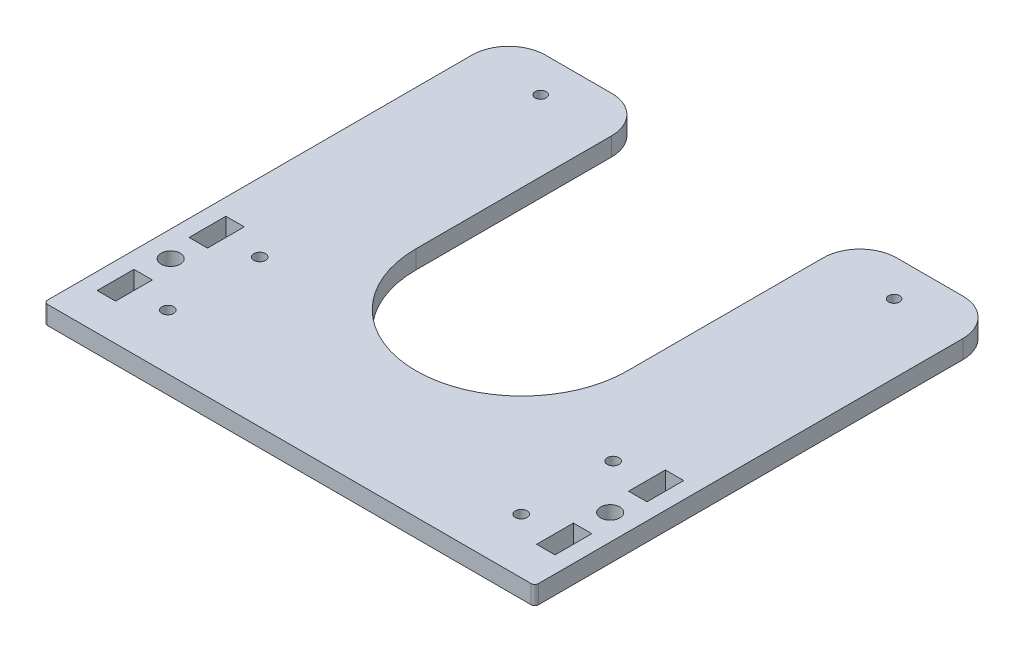
from build123d import *

# Parameters (mm, degrees)
SKETCH1_W           = 133.5
SKETCH1_H           = 126.4
SKETCH1_R           = 2.6
SKETCH1_R_2         = 1.6
SKETCH1_W_2         = 5
SKETCH1_H_2         = 10
BOSS_EXTRUDE1_DEPTH = 5
CUT_EXTRUDE2_DEPTH  = 10
FILLET2_R           = 10
CUT_EXTRUDE3_REACH  = 94.059
SKETCH5_R           = 1.6
SKETCH5_R_2         = 1.5
FILLET3_R           = 1


with BuildPart() as part:
    # Sketch1 → Boss-Extrude1 (new body)
    with BuildSketch(Plane(origin=(0, 0, 0), x_dir=(1, 0, 0), z_dir=(0, 1, 0))):
        Rectangle(SKETCH1_W, SKETCH1_H)
        with Locations(Location((-59.75, -35.7, 0), (0, 0, 270))):
            Circle(SKETCH1_R, mode=Mode.SUBTRACT)
        with Locations(Location((59.75, -35.7, 0), (0, 0, 90))):
            Circle(SKETCH1_R, mode=Mode.SUBTRACT)
        with Locations(Location((-48.05, -48.2, 0), (0, 0, 270))):
            Circle(SKETCH1_R_2, mode=Mode.SUBTRACT)
        with Locations(Location((48.05, -48.2, 0), (0, 0, 90))):
            Circle(SKETCH1_R_2, mode=Mode.SUBTRACT)
        with Locations((-59.75, -48.2)):
            Rectangle(SKETCH1_W_2, SKETCH1_H_2, mode=Mode.SUBTRACT)
        with Locations((-59.75, -23.2)):
            Rectangle(SKETCH1_W_2, SKETCH1_H_2, mode=Mode.SUBTRACT)
        with Locations((59.75, -23.2)):
            Rectangle(SKETCH1_W_2, SKETCH1_H_2, mode=Mode.SUBTRACT)
        with Locations((59.75, -48.2)):
            Rectangle(SKETCH1_W_2, SKETCH1_H_2, mode=Mode.SUBTRACT)
    extrude(amount=BOSS_EXTRUDE1_DEPTH)

    # Sketch2 → Cut-Extrude2 (cut)
    with BuildSketch(Plane(origin=(0, 5, 0), x_dir=(1, 0, 0), z_dir=(0, 1, 0))):
        with BuildLine():
            Line((-28.75, 86.678700037), (-28.75, 0))
            ThreePointArc((-28.75, 0), (0, -28.75), (28.75, 0))
            Line((28.75, 0), (28.75, 86.678700037))
            Line((28.75, 86.678700037), (-28.75, 86.678700037))
        make_face()
    extrude(amount=-CUT_EXTRUDE2_DEPTH, mode=Mode.SUBTRACT)

    # Fillet2
    fillet2_edges = [part.edges().sort_by_distance(p)[0] for p in [
        (-66.75, 2.5, -63.2),
        (66.75, 2.5, -63.2),
        (-28.75, 2.5, -63.2),
        (28.75, 2.5, -63.2),
    ]]
    fillet(fillet2_edges, radius=FILLET2_R)

    # Sketch5 → Cut-Extrude3 (cut, up to next)
    with BuildSketch(Plane.XZ, mode=Mode.PRIVATE) as cut_extrude3_sk1:
        with Locations(Location((48.05, 23.2, 0), (0, 0, 270))):
            Circle(SKETCH5_R)
    cut_extrude3_tool1 = extrude(cut_extrude3_sk1.sketch, amount=-CUT_EXTRUDE3_REACH, mode=Mode.PRIVATE) & part.part
    # Sketch5 → Cut-Extrude3 (cut, up to next)
    with BuildSketch(Plane.XZ, mode=Mode.PRIVATE) as cut_extrude3_sk2:
        with Locations(Location((48.05, -53.2, 0), (0, 0, 270))):
            Circle(SKETCH5_R_2)
    cut_extrude3_tool2 = extrude(cut_extrude3_sk2.sketch, amount=-CUT_EXTRUDE3_REACH, mode=Mode.PRIVATE) & part.part
    # Sketch5 → Cut-Extrude3 (cut, up to next)
    with BuildSketch(Plane.XZ, mode=Mode.PRIVATE) as cut_extrude3_sk3:
        with Locations(Location((-48.05, -53.2, 0), (0, 0, 90))):
            Circle(SKETCH5_R_2)
    cut_extrude3_tool3 = extrude(cut_extrude3_sk3.sketch, amount=-CUT_EXTRUDE3_REACH, mode=Mode.PRIVATE) & part.part
    # Sketch5 → Cut-Extrude3 (cut, up to next)
    with BuildSketch(Plane.XZ, mode=Mode.PRIVATE) as cut_extrude3_sk4:
        with Locations(Location((-48.05, 23.2, 0), (0, 0, 90))):
            Circle(SKETCH5_R)
    cut_extrude3_tool4 = extrude(cut_extrude3_sk4.sketch, amount=-CUT_EXTRUDE3_REACH, mode=Mode.PRIVATE) & part.part
    add(cut_extrude3_tool1.solids().sort_by_distance((48.05, 0, 23.2))[0], mode=Mode.SUBTRACT)
    add(cut_extrude3_tool2.solids().sort_by_distance((48.05, 0, -53.2))[0], mode=Mode.SUBTRACT)
    add(cut_extrude3_tool3.solids().sort_by_distance((-48.05, 0, -53.2))[0], mode=Mode.SUBTRACT)
    add(cut_extrude3_tool4.solids().sort_by_distance((-48.05, 0, 23.2))[0], mode=Mode.SUBTRACT)

    # Fillet3
    fillet3_edges = [part.edges().sort_by_distance(p)[0] for p in [
        (66.75, 2.5, 63.2),
        (-66.75, 2.5, 63.2),
    ]]
    fillet(fillet3_edges, radius=FILLET3_R)


solid = part.part
